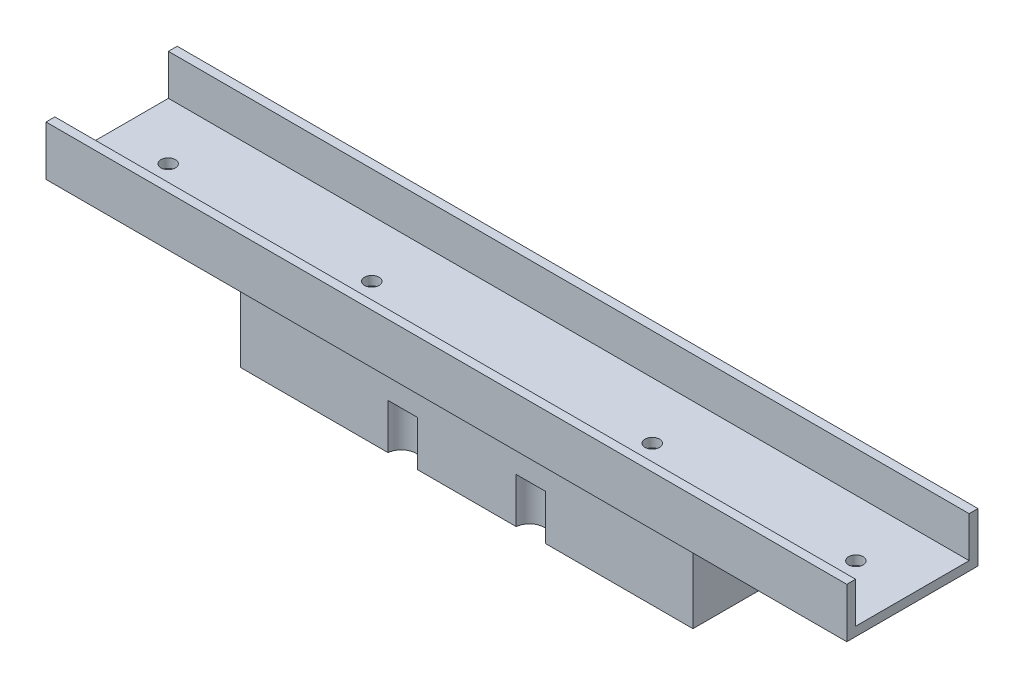
from build123d import *

# Parameters (mm, degrees)
BOSS_EXTRUDE1_DEPTH             = 88.5
SKETCH3_W                       = 100
SKETCH3_H                       = 20
BOSS_EXTRUDE2_DEPTH             = 19
CUT_EXTRUDE1_DEPTH              = 16
CUT_EXTRUDE1_DEPTH_BACK         = 92.670605976
SKETCH2_R                       = 1.6
SKETCH4_R                       = 3
CUT_EXTRUDE2_DEPTH              = 19
M3X0_5_TAPPED_HOLE1_D           = 2.5
M3X0_5_TAPPED_HOLE1_DEPTH       = 7.5
M3X0_5_TAPPED_HOLE1_CSINK_D     = 3.05
M3X0_5_TAPPED_HOLE1_CSINK_ANGLE = 90
M3X0_5_TAPPED_HOLE1_TIP         = 0.751075774
SKETCH9_R                       = 3.25
CUT_EXTRUDE3_DEPTH              = 10


with BuildPart() as part:
    # Sketch1 → Boss-Extrude1 (new, symmetric)
    with BuildSketch(Plane(origin=(0, 0, 0), x_dir=(0, 0, -1), z_dir=(1, 0, 0))):
        Polygon((-14.5, 0), (14.5, 0), (14.5, 11), (12.55, 11), (12.55, 2), (-12.55, 2), (-12.55, 11), (-14.5, 11), align=None)
    extrude(amount=BOSS_EXTRUDE1_DEPTH, both=True)

    # Sketch3 → Boss-Extrude2 (add)
    with BuildSketch(Plane.XZ):
        Rectangle(SKETCH3_W, SKETCH3_H)
    extrude(amount=BOSS_EXTRUDE2_DEPTH)

    # Sketch2 → Cut-Extrude1 (cut, two sides: drawn at the far end of the back side and taken through both)
    with BuildSketch(Plane.XZ.offset(-CUT_EXTRUDE1_DEPTH_BACK)):
        with Locations(Location((76, 0, 0), (0, 0, 90))):
            Circle(SKETCH2_R)
        with Locations(Location((31, 0, 0), (0, 0, 270))):
            Circle(SKETCH2_R)
        with Locations(Location((-31, 0, 0), (0, 0, 90))):
            Circle(SKETCH2_R)
        with Locations(Location((-76, 0, 0), (0, 0, 90))):
            Circle(SKETCH2_R)
    extrude(amount=CUT_EXTRUDE1_DEPTH + CUT_EXTRUDE1_DEPTH_BACK, mode=Mode.SUBTRACT)

    # Sketch4 → Cut-Extrude2 (cut)
    with BuildSketch(Plane.XZ.offset(19)):
        with Locations(Location((-31, 0, 0), (0, 0, 270))):
            Circle(SKETCH4_R)
        with Locations(Location((31, 0, 0), (0, 0, 270))):
            Circle(SKETCH4_R)
    extrude(amount=-CUT_EXTRUDE2_DEPTH, mode=Mode.SUBTRACT)

    # M3x0.5 Tapped Hole1
    with Locations(Plane(origin=(0, -19, 0), x_dir=(-1, 0, 0), z_dir=(0, -1, 0))):
        with Locations((-26.5, -6), (26.5, 6), (26.5, -6), (-26.5, 6)):
            CounterSinkHole(M3X0_5_TAPPED_HOLE1_D / 2, M3X0_5_TAPPED_HOLE1_CSINK_D / 2, depth=M3X0_5_TAPPED_HOLE1_DEPTH, counter_sink_angle=M3X0_5_TAPPED_HOLE1_CSINK_ANGLE)
            with Locations((0, 0, -(M3X0_5_TAPPED_HOLE1_DEPTH + M3X0_5_TAPPED_HOLE1_TIP / 2))):  # 118° drill point
                Cone(0, M3X0_5_TAPPED_HOLE1_D / 2, M3X0_5_TAPPED_HOLE1_TIP, mode=Mode.SUBTRACT)

    # Sketch9 → Cut-Extrude3 (cut)
    with BuildSketch(Plane.XZ.offset(19)):
        with Locations((14.158699622, -10.285)):
            Circle(SKETCH9_R)
        with Locations((-14.158699622, -10.285)):
            Circle(SKETCH9_R)
        with Locations((-14.158699622, 10.285)):
            Circle(SKETCH9_R)
        with Locations((14.158699622, 10.285)):
            Circle(SKETCH9_R)
    extrude(amount=-CUT_EXTRUDE3_DEPTH, mode=Mode.SUBTRACT)


solid = part.part
